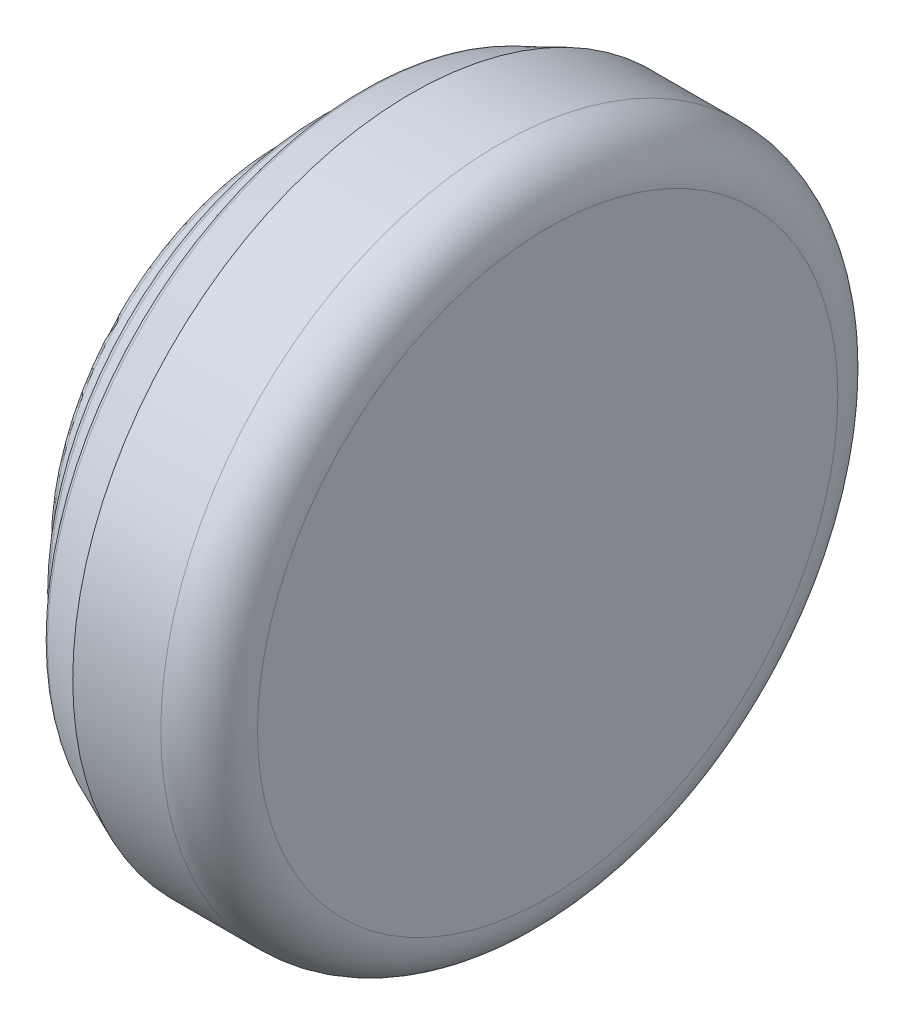
from build123d import *

# Parameters (mm, degrees)
REDONDEO3_R = 5


with BuildPart() as part:
    # Croquis1 → Revolución1 (revolve)
    with BuildSketch(Plane(origin=(0, 0, 0), x_dir=(1, 0, 0), z_dir=(0, 1, 0))):
        with BuildLine():
            Line((106.445710743, 140), (70.03994637, 140))
            Line((70.03994637, 140), (48.737618848, 130.932753785))
            Line((48.737618848, 130.932753785), (48.737618848, 120.610275725))
            Line((48.737618848, 120.610275725), (31.868809424, 113.430137863))
            Line((31.868809424, 113.430137863), (31.868809424, 102.180137863))
            Line((31.868809424, 102.180137863), (15, 95))
            Line((15, 95), (15, 0))
            Line((15, 0), (70, 0))
            Line((70, 0), (126.445710743, 0))
            Line((126.445710743, 0), (126.445710743, 120))
            ThreePointArc((126.445710743, 120), (120.587846367, 134.142135624), (106.445710743, 140))
        make_face()
    revolve(axis=Axis((-209.218950064, 0, 0), (1, 0, 0)))

    # Redondeo3
    redondeo3_edges = [part.edges().sort_by_distance(p)[0] for p in [
        (15, 0, 95),
        (31.868809424, 0, 102.180137863),
        (31.868809424, 0, 113.430137863),
        (48.737618848, 0, 120.610275725),
        (48.737618848, 0, 130.932753785),
    ]]
    fillet(redondeo3_edges, radius=REDONDEO3_R)


solid = part.part
